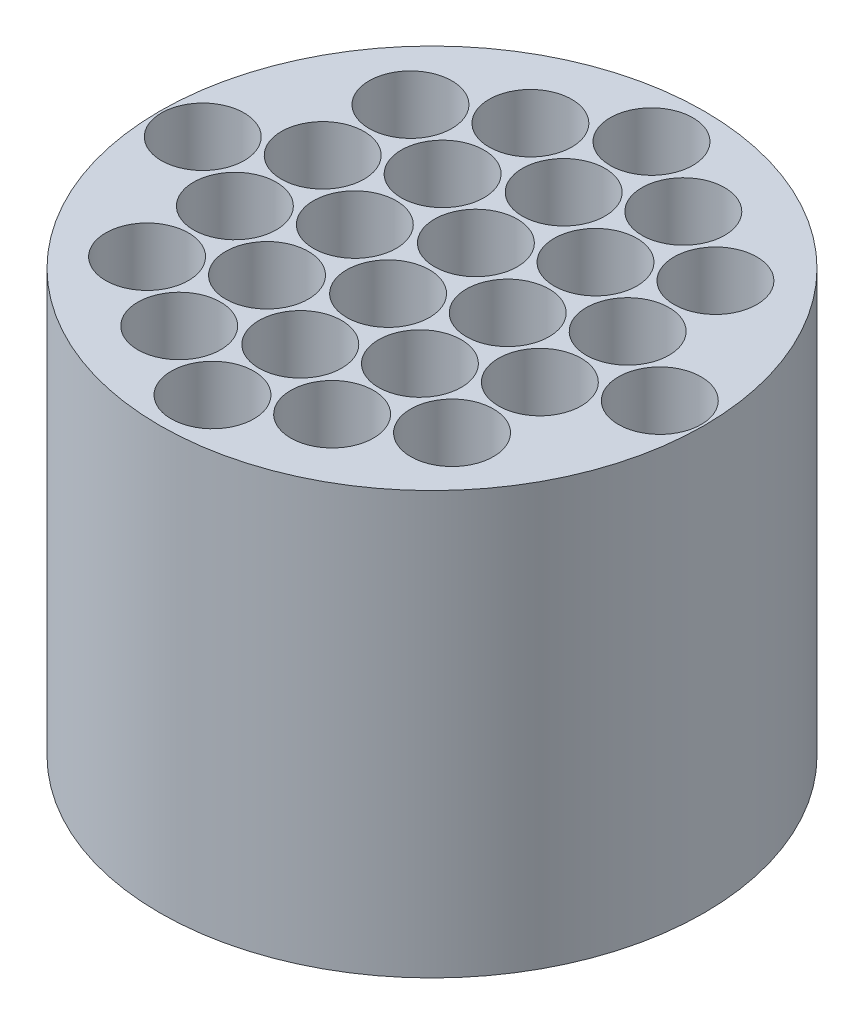
from build123d import *

# Parameters (mm, degrees)
SKETCH1_R           = 16.125
BOSS_EXTRUDE1_DEPTH = 25
SKETCH2_R           = 2.45
CUT_EXTRUDE1_DEPTH  = 18.75
SKETCH3_R           = 2.45
CUT_EXTRUDE2_DEPTH  = 18.75
SKETCH4_R           = 2.45
CUT_EXTRUDE3_DEPTH  = 18.75
SKETCH5_R           = 2.45
CUT_EXTRUDE5_DEPTH  = 18.75


with BuildPart() as part:
    # Sketch1 → Boss-Extrude1 (new body)
    with BuildSketch(Plane(origin=(0, 0, 0), x_dir=(1, 0, 0), z_dir=(0, 1, 0))):
        with Locations(Location((0, 0, 0), (0, 0, 270))):
            Circle(SKETCH1_R)
    extrude(amount=BOSS_EXTRUDE1_DEPTH)

    # Sketch2 → Cut-Extrude1 (cut)
    with BuildSketch(Plane(origin=(0, 25, 0), x_dir=(1, 0, 0), z_dir=(0, 1, 0))):
        with Locations(Location((0, -2.6, 0), (0, 0, 270))):
            Circle(SKETCH2_R)
        with Locations(Location((0, 2.6, 0), (0, 0, 270))):
            Circle(SKETCH2_R)
        with Locations(Location((0, 7.8, 0), (0, 0, 270))):
            Circle(SKETCH2_R)
        with Locations(Location((0, 13, 0), (0, 0, 270))):
            Circle(SKETCH2_R)
        with Locations(Location((0, -7.8, 0), (0, 0, 270))):
            Circle(SKETCH2_R)
        with Locations(Location((0, -13, 0), (0, 0, 270))):
            Circle(SKETCH2_R)
    extrude(amount=-CUT_EXTRUDE1_DEPTH, mode=Mode.SUBTRACT)

    # Sketch3 → Cut-Extrude2 (cut)
    with BuildSketch(Plane(origin=(0, 25, 0), x_dir=(1, 0, 0), z_dir=(0, 1, 0))):
        with Locations(Location((4.528018354, -0.043234507, 0), (0, 0, 270))):
            Circle(SKETCH3_R)
        with Locations(Location((4.528018354, 5.156765493, 0), (0, 0, 270))):
            Circle(SKETCH3_R)
        with Locations(Location((4.528018354, -5.243234507, 0), (0, 0, 270))):
            Circle(SKETCH3_R)
        with Locations(Location((4.528018354, -10.443234507, 0), (0, 0, 270))):
            Circle(SKETCH3_R)
        with Locations(Location((4.528018354, 10.356765493, 0), (0, 0, 270))):
            Circle(SKETCH3_R)
    cut_extrude2 = extrude(amount=-CUT_EXTRUDE2_DEPTH, mode=Mode.SUBTRACT)

    # Sketch4 → Cut-Extrude3 (cut)
    with BuildSketch(Plane(origin=(0, 25, 0), x_dir=(1, 0, 0), z_dir=(0, 1, 0))):
        with Locations(Location((9.031350453, 7.756765493, 0), (0, 0, 270))):
            Circle(SKETCH4_R)
        with Locations(Location((9.031350453, 2.556765493, 0), (0, 0, 270))):
            Circle(SKETCH4_R)
        with Locations(Location((9.031350453, -2.643234507, 0), (0, 0, 270))):
            Circle(SKETCH4_R)
        with Locations(Location((9.031350453, -7.843234507, 0), (0, 0, 270))):
            Circle(SKETCH4_R)
    cut_extrude3 = extrude(amount=-CUT_EXTRUDE3_DEPTH, mode=Mode.SUBTRACT)

    # Sketch5 → Cut-Extrude5 (cut)
    with BuildSketch(Plane(origin=(0, 25, 0), x_dir=(1, 0, 0), z_dir=(0, 1, 0))):
        with Locations(Location((13.534682553, -0.043234507, 0), (0, 0, 270))):
            Circle(SKETCH5_R)
    cut_extrude5 = extrude(amount=-CUT_EXTRUDE5_DEPTH, mode=Mode.SUBTRACT)

    # Mirror2: Cut-Extrude2, Cut-Extrude3, Cut-Extrude5 across plane
    add(cut_extrude2.mirror(Plane(origin=(0, 0, 0), x_dir=(0, 0, 1), z_dir=(1, 0, 0))), mode=Mode.SUBTRACT)
    add(cut_extrude3.mirror(Plane(origin=(0, 0, 0), x_dir=(0, 0, 1), z_dir=(1, 0, 0))), mode=Mode.SUBTRACT)
    add(cut_extrude5.mirror(Plane(origin=(0, 0, 0), x_dir=(0, 0, 1), z_dir=(1, 0, 0))), mode=Mode.SUBTRACT)


solid = part.part
